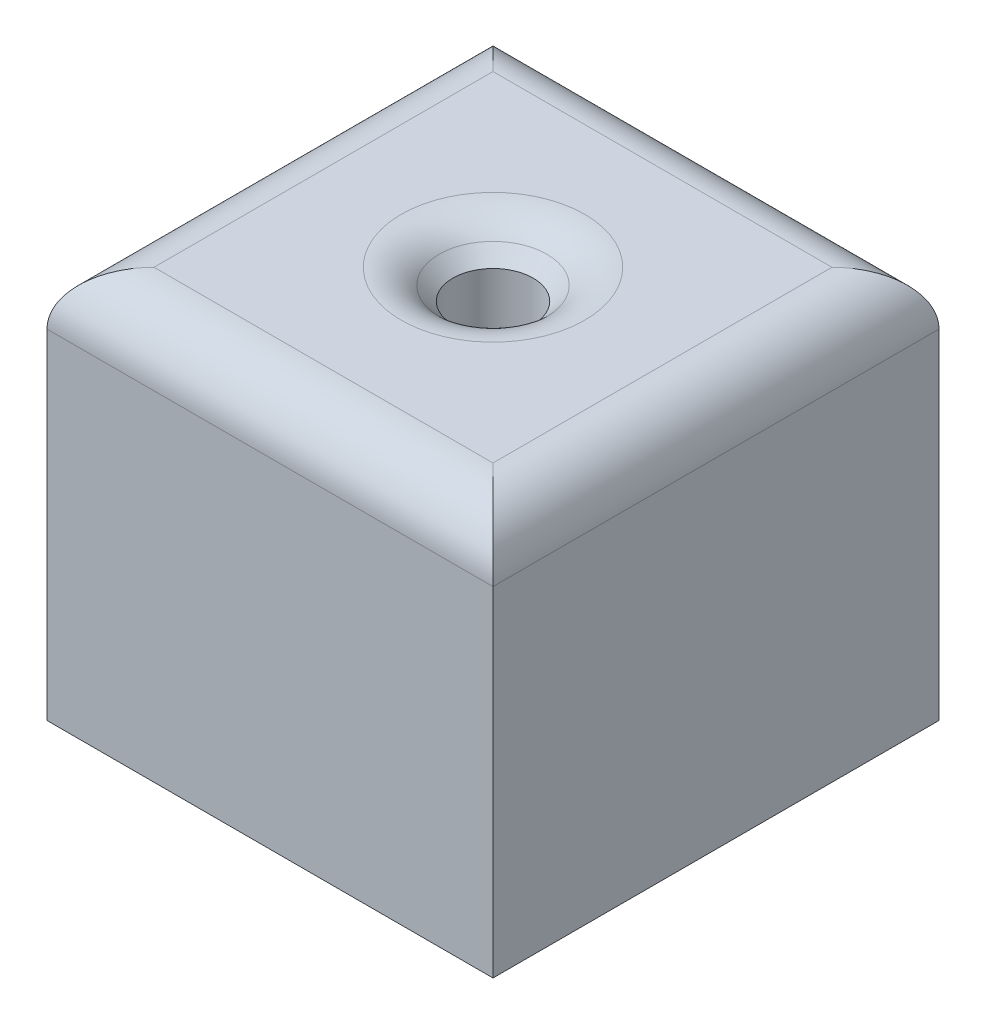
from build123d import *

# Parameters (mm, degrees)
SKETCH_1_W      = 25
SKETCH_1_H      = 25
EXTRUDE_1_DEPTH = 25
FILLET_1_R      = 3
CHAMFER_1_SIZE  = 3


with BuildPart() as part:
    # 草图1 → 凸台-拉伸1 (new body)
    with BuildSketch(Plane.XY):
        with Locations((12.5, 12.5)):
            Rectangle(SKETCH_1_W, SKETCH_1_H)
    extrude(amount=EXTRUDE_1_DEPTH)

    # 草图3 → 切除-旋转1 (revolve, cut)
    with BuildSketch(Plane.XY.offset(12.5), mode=Mode.PRIVATE) as cut_revolve_1_sk:
        Polygon((10.25, 23.35), (10.25, 0), (12.5, 0), (12.5, 25), (8.6, 25), align=None)
    revolve(cut_revolve_1_sk.sketch.rotate(Axis((12.5, 25, 12.5), (0, -1, 0)), 270), axis=Axis((12.5, 25, 12.5), (0, -1, 0)), mode=Mode.SUBTRACT)

    # 圆角1
    fillet_1_edges = [part.edges().sort_by_distance(p)[0] for p in [
        (12.5, 25, 25),
        (12.5, 25, 8.6),
        (12.5, 25, 0),
        (0, 25, 12.5),
        (25, 25, 12.5),
    ]]
    fillet(fillet_1_edges, radius=FILLET_1_R)

    # 倒角1
    chamfer_1_edges = [part.edges().sort_by_distance(p)[0] for p in [
        (12.5, 0, 10.25),
        (12.5, 0, 0),
        (25, 0, 12.5),
        (0, 0, 12.5),
        (12.5, 0, 25),
    ]]
    chamfer(chamfer_1_edges, length=CHAMFER_1_SIZE)


solid = part.part
